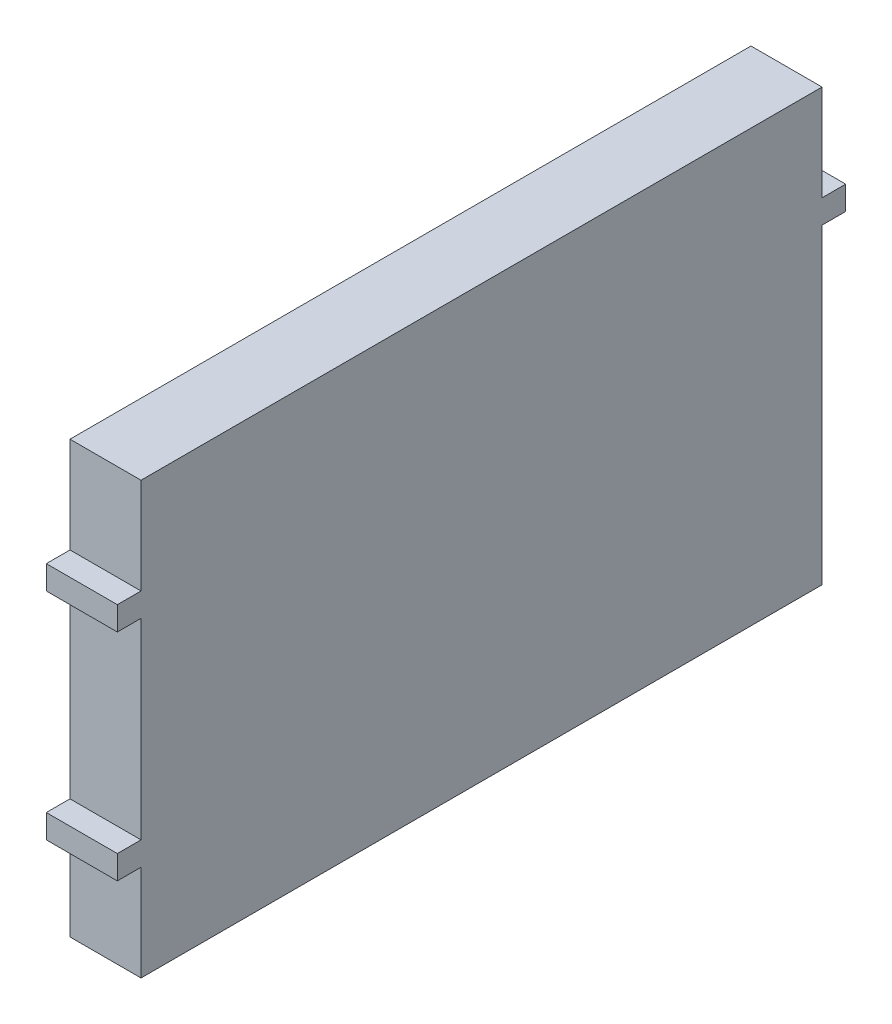
from build123d import *

# Parameters (mm, degrees)
BOSS_EXTRUDE1_DEPTH = 9.525


with BuildPart() as part:
    # Sketch1 → Boss-Extrude1 (new body)
    with BuildSketch(Plane(origin=(243.017706631, 0, 0), x_dir=(0, 0, -1), z_dir=(1, 0, 0))):
        Polygon((-776.881194078, 374.591708455), (-773.706194078, 374.591708455), (-773.706194078, 361.732958455), (-682.424944078, 361.732958455), (-682.424944078, 403.484208455), (-679.249944078, 403.484208455), (-679.249944078, 406.659208455), (-682.424944078, 406.659208455), (-682.424944078, 419.517958455), (-773.706194078, 419.517958455), (-773.706194078, 406.659208455), (-776.881194078, 406.659208455), (-776.881194078, 403.484208455), (-773.706194078, 403.484208455), (-773.706194078, 377.766708455), (-776.881194078, 377.766708455), align=None)
    extrude(amount=BOSS_EXTRUDE1_DEPTH)


solid = part.part
